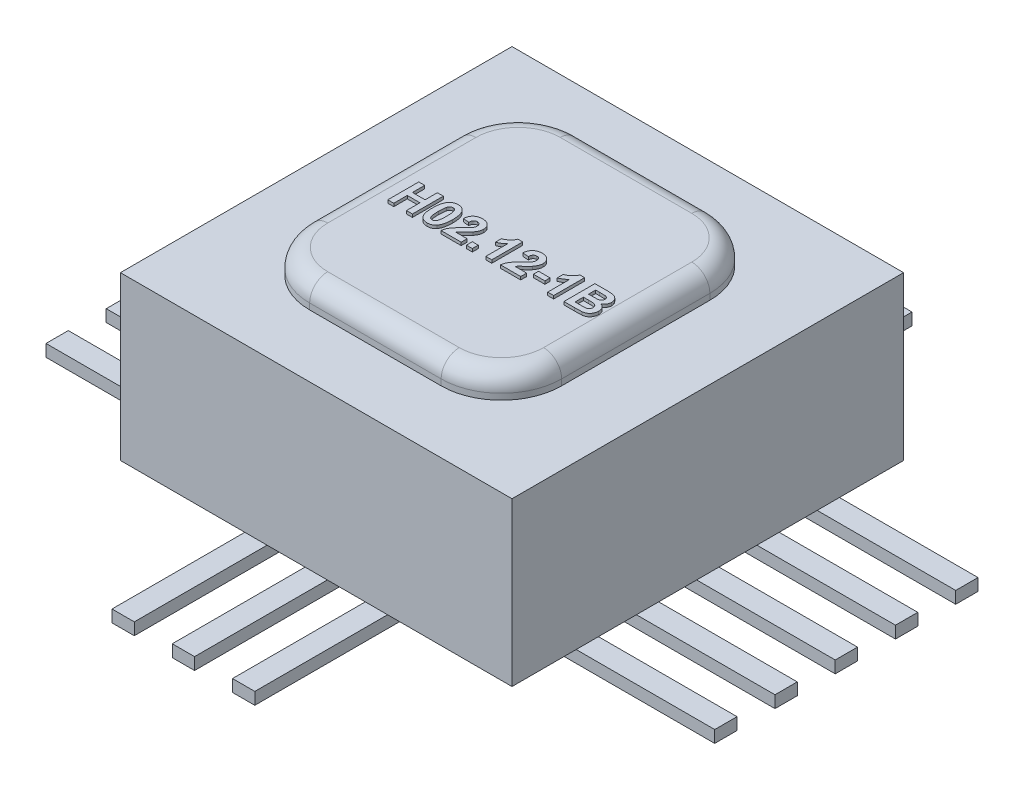
from build123d import *

# Parameters (mm, degrees)
SKETCH_1_W      = 6.5
SKETCH_1_H      = 6.5
EXTRUDE_1_DEPTH = 2.7
EXTRUDE_2_DEPTH = 0.4
SKETCH_3_W      = 0.098781487
SKETCH_3_H      = 0.098781488
SKETCH_3_W_2    = 0.190977544
SKETCH_3_H_2    = 0.085610623
EXTRUDE_3_DEPTH = 0.05
SKETCH_4_W      = 2.8
SKETCH_4_H      = 0.37
EXTRUDE_4_DEPTH = 0.2
FILLET_1_R      = 0.3


with BuildPart() as part:
    # Эскиз1 → Бобышка-Вытянуть1 (new body)
    with BuildSketch(Plane(origin=(0, 0, 0), x_dir=(1, 0, 0), z_dir=(0, 1, 0))):
        with Locations((-4.246969697, 1.663636364)):
            Rectangle(SKETCH_1_W, SKETCH_1_H)
    extrude(amount=EXTRUDE_1_DEPTH)

    # Эскиз2 → Бобышка-Вытянуть2 (add)
    with BuildSketch(Plane(origin=(0, 2.7, 0), x_dir=(1, 0, 0), z_dir=(0, 1, 0))):
        with BuildLine():
            Line((-5.389923562, 3.908173911), (-3.207496013, 3.908173911))
            ThreePointArc((-3.207496013, 3.908173911), (-2.500389232, 3.615280692), (-2.207496013, 2.908173911))
            Line((-2.207496013, 2.908173911), (-2.207496013, 0.448176813))
            ThreePointArc((-2.207496013, 0.448176813), (-2.500389232, -0.258929968), (-3.207496013, -0.551823187))
            Line((-3.207496013, -0.551823187), (-5.389923562, -0.551823187))
            ThreePointArc((-5.389923562, -0.551823187), (-6.097030343, -0.258929968), (-6.389923562, 0.448176813))
            Line((-6.389923562, 0.448176813), (-6.389923562, 2.908173911))
            ThreePointArc((-6.389923562, 2.908173911), (-6.097030343, 3.615280692), (-5.389923562, 3.908173911))
        make_face()
    extrude(amount=EXTRUDE_2_DEPTH)

    # Эскиз3 → Бобышка-Вытянуть3 (add)
    # profile 1 of 9: a face of its own
    with BuildSketch(Plane(origin=(0, 3.1, 0), x_dir=(1, 0, 0), z_dir=(0, 1, 0))):
        Polygon((-5.875120477, 1.230387729), (-5.875120477, 1.744051466), (-5.77633899, 1.744051466), (-5.77633899, 1.539903058), (-5.565605149, 1.539903058), (-5.565605149, 1.744051466), (-5.466823661, 1.744051466), (-5.466823661, 1.230387729), (-5.565605149, 1.230387729), (-5.565605149, 1.454292435), (-5.77633899, 1.454292435), (-5.77633899, 1.230387729), align=None)
    # profile 2 of 9: a face of its own
    with BuildSketch(Plane(origin=(0, 3.1, 0), x_dir=(1, 0, 0), z_dir=(0, 1, 0))):
        with BuildLine():
            add(Edge.make_bspline(
                [(-5.219869941, 1.744051466), (-5.213755631, 1.743903993), (-5.201851771, 1.743616879), (-5.184506535, 1.741073574), (-5.168175133, 1.736995527), (-5.152858762, 1.731230917), (-5.138571772, 1.723745239), (-5.125409327, 1.714506502), (-5.113083812, 1.703791648), (-5.105966277, 1.695476743), (-5.10236113, 1.691265108)],
                knots=[0, 0, 0, 0, 1.098584764, 2.138818609, 3.143716932, 4.11936356, 5.073598562, 6.034819447, 7.004603936, 8, 8, 8, 8], degree=3))
            add(Edge.make_bspline(
                [(-5.10236113, 1.691265108), (-5.100298928, 1.688582853), (-5.096090335, 1.68310884), (-5.090422306, 1.67426344), (-5.084973267, 1.664880422), (-5.080216789, 1.654733933), (-5.075662254, 1.644000048), (-5.071441496, 1.63265431), (-5.067776742, 1.620602975), (-5.064328424, 1.608000142), (-5.061518361, 1.594648985), (-5.058921603, 1.580693636), (-5.056768773, 1.566070831), (-5.05507114, 1.550827354), (-5.053554986, 1.534986398), (-5.052724207, 1.518472371), (-5.052043976, 1.501322147), (-5.051975993, 1.489655609), (-5.051941412, 1.483721086)],
                knots=[0, 0, 0, 0, 0.746761706, 1.524009783, 2.317797294, 3.140957436, 3.996208027, 4.892396322, 5.812273159, 6.776774596, 7.776522781, 8.823794876, 9.910947555, 11.039215469, 12.21036455, 13.424061321, 14.689674014, 16, 16, 16, 16], degree=3))
            add(Edge.make_bspline(
                [(-5.051941412, 1.483721086), (-5.051975472, 1.47778655), (-5.052042234, 1.466154265), (-5.052726743, 1.449038447), (-5.053555727, 1.432558851), (-5.055067603, 1.416717049), (-5.056781491, 1.401476602), (-5.058872769, 1.386870189), (-5.061664937, 1.372978966), (-5.064430795, 1.359649102), (-5.067858897, 1.34699261), (-5.071688337, 1.334962887), (-5.075739452, 1.323475714), (-5.08039988, 1.31272801), (-5.085327023, 1.302568965), (-5.09069497, 1.293090173), (-5.096426287, 1.284189955), (-5.100675595, 1.278687063), (-5.102772719, 1.27597127)],
                knots=[0, 0, 0, 0, 1.308387162, 2.564569672, 3.776470597, 4.945886788, 6.07248526, 7.158029334, 8.197718558, 9.195987466, 10.159061779, 11.087054987, 11.979325145, 12.84323098, 13.668471539, 14.467659354, 15.243757377, 16, 16, 16, 16], degree=3))
            add(Edge.make_bspline(
                [(-5.102772719, 1.27597127), (-5.106344882, 1.271795734), (-5.113396504, 1.263553026), (-5.125585605, 1.252927031), (-5.138726229, 1.243879364), (-5.152988055, 1.236542445), (-5.168229585, 1.230738059), (-5.184587713, 1.226790142), (-5.201885563, 1.22424166), (-5.213789641, 1.22395084), (-5.219869941, 1.223802296)],
                knots=[0, 0, 0, 0, 0.991631672, 1.957528776, 2.911425699, 3.867574088, 4.848108326, 5.850523106, 6.902101959, 8, 8, 8, 8], degree=3))
            add(Edge.make_bspline(
                [(-5.219869941, 1.223802296), (-5.226019737, 1.223979255), (-5.23807058, 1.224326013), (-5.255665334, 1.227074869), (-5.272389954, 1.231478519), (-5.288184401, 1.237765757), (-5.303026075, 1.245913557), (-5.317030926, 1.255680521), (-5.329894263, 1.267508902), (-5.339964853, 1.278520471), (-5.347332527, 1.288470234), (-5.352528902, 1.296720934), (-5.357550644, 1.305549511), (-5.361885011, 1.315231993), (-5.366161249, 1.325482), (-5.369948652, 1.336520433), (-5.373290123, 1.348252374), (-5.376427551, 1.360624251), (-5.379043704, 1.373721281), (-5.381450181, 1.387504815), (-5.383346615, 1.402033471), (-5.385027998, 1.417226325), (-5.386211789, 1.433119244), (-5.387173178, 1.449686217), (-5.387655248, 1.466980277), (-5.38775009, 1.47874749), (-5.387798471, 1.48475006)],
                knots=[0, 0, 0, 0, 1.257818097, 2.464759732, 3.634271214, 4.790227596, 5.933394726, 7.09190477, 8.274482889, 9.50191983, 10.139172818, 10.805000628, 11.49619854, 12.215266328, 12.973768034, 13.768328009, 14.601232062, 15.469317089, 16.379095881, 17.333267023, 18.331755967, 19.376479622, 20.460535752, 21.592206075, 22.771760786, 24, 24, 24, 24], degree=3))
            add(Edge.make_bspline(
                [(-5.387798471, 1.48475006), (-5.387764682, 1.490650321), (-5.387698461, 1.502214074), (-5.387008961, 1.519260962), (-5.386190932, 1.535672889), (-5.384662599, 1.55147858), (-5.382972751, 1.566653949), (-5.380842724, 1.581219001), (-5.378119978, 1.595098381), (-5.375155496, 1.608347483), (-5.371903663, 1.621013228), (-5.368038623, 1.632989746), (-5.364027998, 1.644458174), (-5.3593131, 1.655148549), (-5.354416207, 1.665286213), (-5.34904406, 1.674763228), (-5.3433138, 1.683663894), (-5.339064355, 1.689166728), (-5.336967163, 1.691882493)],
                knots=[0, 0, 0, 0, 1.304469132, 2.556591843, 3.77188756, 4.93702727, 6.066781583, 7.147865049, 8.190466662, 9.19316792, 10.149665317, 11.080258032, 11.975027628, 12.834388201, 13.661940433, 14.463366943, 15.241638981, 16, 16, 16, 16], degree=3))
            add(Edge.make_bspline(
                [(-5.336967163, 1.691882493), (-5.333395197, 1.69605843), (-5.326343963, 1.704301931), (-5.314152023, 1.714922121), (-5.300996871, 1.724008842), (-5.286693306, 1.731257941), (-5.271486717, 1.737141902), (-5.255149996, 1.741058316), (-5.237854902, 1.743613525), (-5.225950438, 1.743903403), (-5.219869941, 1.744051466)],
                knots=[0, 0, 0, 0, 0.991667276, 1.957599061, 2.911530233, 3.873218945, 4.847995157, 5.850445929, 6.902062539, 8, 8, 8, 8], degree=3))
        make_face()
        with BuildLine():
            add(Edge.make_bspline(
                [(-5.219869941, 1.658440843), (-5.22300218, 1.658297312), (-5.229198033, 1.658013393), (-5.238203568, 1.655909283), (-5.246708554, 1.652437043), (-5.254753989, 1.647589841), (-5.262162089, 1.640846715), (-5.268437415, 1.631805631), (-5.273856918, 1.620710722), (-5.276569082, 1.612417735), (-5.278006963, 1.608021125)],
                knots=[0, 0, 0, 0, 0.899391665, 1.779078861, 2.640979247, 3.529945348, 4.464599804, 5.495588918, 6.672261578, 8, 8, 8, 8], degree=3))
            add(Edge.make_bspline(
                [(-5.278006963, 1.608021125), (-5.278904944, 1.604703762), (-5.280834943, 1.59757387), (-5.283025412, 1.585949182), (-5.284831847, 1.572756392), (-5.286357199, 1.557998566), (-5.287598513, 1.541667895), (-5.288362958, 1.523753987), (-5.288891328, 1.504269394), (-5.288973983, 1.490752808), (-5.289016983, 1.483721086)],
                knots=[0, 0, 0, 0, 0.658986521, 1.416336438, 2.266694271, 3.212608458, 4.261595115, 5.407496572, 6.651304179, 8, 8, 8, 8], degree=3))
            add(Edge.make_bspline(
                [(-5.289016983, 1.483721086), (-5.28895836, 1.476724151), (-5.288845991, 1.463312198), (-5.2885269, 1.444061929), (-5.287621155, 1.426538758), (-5.286714591, 1.410672856), (-5.285204669, 1.396514212), (-5.283686001, 1.384024595), (-5.281592768, 1.373289304), (-5.278736672, 1.361612744), (-5.274417193, 1.349391372), (-5.268490996, 1.337061801), (-5.262136087, 1.327161733), (-5.254651143, 1.320073351), (-5.24655024, 1.31531829), (-5.23814798, 1.311824497), (-5.229150646, 1.309864004), (-5.223000034, 1.309565056), (-5.219869941, 1.309412919)],
                knots=[0, 0, 0, 0, 1.613353868, 3.092528792, 4.438413522, 5.658843895, 6.755779493, 7.721003256, 8.558527904, 9.275869043, 10.491421475, 11.538327284, 12.426656321, 13.187490948, 13.890032692, 14.581719216, 15.278226227, 16, 16, 16, 16], degree=3))
            add(Edge.make_bspline(
                [(-5.219869941, 1.309412919), (-5.216701681, 1.309549171), (-5.210501516, 1.30981581), (-5.201484182, 1.311990076), (-5.192967087, 1.315357909), (-5.184975486, 1.32030394), (-5.177574324, 1.327000894), (-5.171303579, 1.336050102), (-5.165882627, 1.347142442), (-5.163170684, 1.35543582), (-5.16173292, 1.359832637)],
                knots=[0, 0, 0, 0, 0.909107913, 1.77908945, 2.650019014, 3.530482969, 4.465025013, 5.495890128, 6.672421267, 8, 8, 8, 8], degree=3))
            add(Edge.make_bspline(
                [(-5.16173292, 1.359832637), (-5.160836237, 1.363150264), (-5.158917815, 1.370248217), (-5.156711737, 1.381800538), (-5.154900412, 1.394924963), (-5.153389563, 1.409615656), (-5.152136039, 1.425911052), (-5.151378084, 1.443791174), (-5.150849217, 1.463241364), (-5.150766059, 1.476723659), (-5.1507229, 1.483721086)],
                knots=[0, 0, 0, 0, 0.66114423, 1.414496391, 2.261103113, 3.210114492, 4.255954433, 5.405607896, 6.653488082, 8, 8, 8, 8], degree=3))
            add(Edge.make_bspline(
                [(-5.1507229, 1.483721086), (-5.150718128, 1.490718755), (-5.15070898, 1.504133168), (-5.151315072, 1.523407872), (-5.151909899, 1.540982659), (-5.153122852, 1.556823101), (-5.154337732, 1.570982696), (-5.1561476, 1.583390552), (-5.157970901, 1.594183424), (-5.161086926, 1.605835651), (-5.165321629, 1.618092145), (-5.171107034, 1.630549834), (-5.177646835, 1.640357099), (-5.185077528, 1.64756593), (-5.193138557, 1.652425508), (-5.201561437, 1.655929903), (-5.2105434, 1.658009923), (-5.216738224, 1.658296146), (-5.219869941, 1.658440843)],
                knots=[0, 0, 0, 0, 1.611146624, 3.088541111, 4.440175916, 5.659517762, 6.746360572, 7.711365618, 8.546319149, 9.264661039, 10.486047304, 11.528122518, 12.419721574, 13.184982167, 13.89070983, 14.574167459, 15.279187713, 16, 16, 16, 16], degree=3))
        make_face(mode=Mode.SUBTRACT)
    # profile 3 of 9: a face of its own
    with BuildSketch(Plane(origin=(0, 3.1, 0), x_dir=(1, 0, 0), z_dir=(0, 1, 0))):
        with BuildLine():
            Line((-4.65681546, 1.329169217), (-4.65681546, 1.230387729))
            Line((-4.65681546, 1.230387729), (-4.992672519, 1.230387729))
            add(Edge.make_bspline(
                [(-4.992672519, 1.230387729), (-4.991535385, 1.23883004), (-4.989261754, 1.255709929), (-4.982232501, 1.280367199), (-4.972850855, 1.30442848), (-4.962668861, 1.324008524), (-4.95254174, 1.339769784), (-4.943353402, 1.352684683), (-4.932392053, 1.366425582), (-4.919816752, 1.381103406), (-4.905696998, 1.39676404), (-4.889927446, 1.413349259), (-4.872432875, 1.430779666), (-4.860125132, 1.442615771), (-4.853761052, 1.448735976)],
                knots=[0, 0, 0, 0, 1.156289446, 2.311930546, 3.473459201, 4.661751613, 5.303057008, 6.018253237, 6.81459331, 7.690699809, 8.644447906, 9.679642995, 10.800191253, 12, 12, 12, 12], degree=3))
            add(Edge.make_bspline(
                [(-4.853761052, 1.448735976), (-4.848682443, 1.453638224), (-4.839014268, 1.46297066), (-4.825246768, 1.476334329), (-4.813143717, 1.48861934), (-4.802452057, 1.499507335), (-4.79341878, 1.50927555), (-4.785925061, 1.517770577), (-4.779875995, 1.525027009), (-4.776599815, 1.529630494), (-4.775147451, 1.531671267)],
                knots=[0, 0, 0, 0, 1.480720495, 2.818855715, 4.024636094, 5.098235712, 6.019786162, 6.815086302, 7.474715479, 8, 8, 8, 8], degree=3))
            add(Edge.make_bspline(
                [(-4.775147451, 1.531671267), (-4.772173363, 1.536611544), (-4.766436692, 1.546140767), (-4.760145957, 1.561125643), (-4.756370023, 1.576107423), (-4.755851863, 1.586118163), (-4.755596948, 1.591043057)],
                knots=[0, 0, 0, 0, 1.0911822, 2.104764037, 3.067617678, 4, 4, 4, 4], degree=3))
            add(Edge.make_bspline(
                [(-4.755596948, 1.591043057), (-4.755781953, 1.596168072), (-4.756131967, 1.6058642), (-4.759066896, 1.619547229), (-4.764271517, 1.631309732), (-4.771437322, 1.641187812), (-4.780498496, 1.64892725), (-4.791091273, 1.654645943), (-4.803370713, 1.657807635), (-4.812001428, 1.658223497), (-4.816512199, 1.658440843)],
                knots=[0, 0, 0, 0, 1.193122327, 2.257294386, 3.237245624, 4.168877528, 5.075331632, 5.990371598, 6.949684428, 8, 8, 8, 8], degree=3))
            add(Edge.make_bspline(
                [(-4.816512199, 1.658440843), (-4.820992496, 1.658237858), (-4.829647462, 1.657845734), (-4.841948047, 1.654420195), (-4.852708789, 1.648490226), (-4.860377466, 1.641732454), (-4.865558021, 1.635161012), (-4.86908787, 1.629434433), (-4.872130325, 1.622927283), (-4.874826194, 1.615712822), (-4.876955625, 1.607708401), (-4.878670537, 1.59897498), (-4.880052508, 1.589465563), (-4.880491999, 1.582850134), (-4.880720166, 1.579415653)],
                knots=[0, 0, 0, 0, 1.402788338, 2.709884207, 3.961032948, 5.225417836, 5.883680772, 6.578928686, 7.329201998, 8.132101139, 8.990263233, 9.922304639, 10.921339128, 12, 12, 12, 12], degree=3))
            Line((-4.880720166, 1.579415653), (-4.979501654, 1.589088007))
            add(Edge.make_bspline(
                [(-4.979501654, 1.589088007), (-4.978707466, 1.595757002), (-4.977167663, 1.608687119), (-4.973325058, 1.627259225), (-4.968458541, 1.644392831), (-4.962336108, 1.66005614), (-4.955210809, 1.674348756), (-4.946719192, 1.687056209), (-4.937157964, 1.698319262), (-4.926518862, 1.70813192), (-4.914869522, 1.7165254), (-4.902645629, 1.724017869), (-4.889608296, 1.730164075), (-4.875901063, 1.735229473), (-4.861530126, 1.739277698), (-4.846429015, 1.741954329), (-4.830690931, 1.743837082), (-4.819948048, 1.743978928), (-4.814454251, 1.744051466)],
                knots=[0, 0, 0, 0, 1.270971563, 2.464210789, 3.586263665, 4.638946707, 5.643716971, 6.603612468, 7.52484387, 8.434700188, 9.336036235, 10.239171475, 11.145359471, 12.059630629, 13.003312604, 13.96741569, 14.960557767, 16, 16, 16, 16], degree=3))
            add(Edge.make_bspline(
                [(-4.814454251, 1.744051466), (-4.808481784, 1.743936678), (-4.796849655, 1.743713115), (-4.779868811, 1.741866926), (-4.763916528, 1.738647828), (-4.74885334, 1.734383677), (-4.734833938, 1.728690723), (-4.721741499, 1.721808179), (-4.709782075, 1.713474838), (-4.698777394, 1.704145153), (-4.68894009, 1.693885524), (-4.680323501, 1.682941895), (-4.673104552, 1.67132189), (-4.667046745, 1.659167146), (-4.662548864, 1.646282073), (-4.659271513, 1.632844837), (-4.657098496, 1.618792752), (-4.656910849, 1.609195496), (-4.65681546, 1.60431682)],
                knots=[0, 0, 0, 0, 1.210756838, 2.35810096, 3.457354827, 4.507168606, 5.527358126, 6.519769748, 7.499700793, 8.476517721, 9.440526811, 10.376769937, 11.295256217, 12.209626307, 13.124630862, 14.055668209, 15.011616881, 16, 16, 16, 16], degree=3))
            add(Edge.make_bspline(
                [(-4.65681546, 1.60431682), (-4.656941134, 1.598717649), (-4.657190451, 1.587609754), (-4.659577475, 1.571188967), (-4.663224385, 1.555146841), (-4.668614229, 1.539444171), (-4.675446275, 1.523704286), (-4.684252947, 1.507891856), (-4.694478159, 1.491530007), (-4.702484096, 1.480951358), (-4.706617794, 1.475489296)],
                knots=[0, 0, 0, 0, 0.953409949, 1.89141903, 2.821310783, 3.752688675, 4.715703262, 5.740811754, 6.833515735, 8, 8, 8, 8], degree=3))
            add(Edge.make_bspline(
                [(-4.706617794, 1.475489296), (-4.70818015, 1.473521504), (-4.711526355, 1.469306949), (-4.717219128, 1.462844581), (-4.723816563, 1.455785638), (-4.731225473, 1.447997993), (-4.739690589, 1.439757428), (-4.748907337, 1.430719328), (-4.759281279, 1.421346023), (-4.770026169, 1.411403694), (-4.780817764, 1.401726965), (-4.790736796, 1.392536218), (-4.799746577, 1.38440438), (-4.807427505, 1.376882538), (-4.814231371, 1.370484051), (-4.81991294, 1.364880813), (-4.824578529, 1.360208473), (-4.83100741, 1.35292548), (-4.839187431, 1.34307523), (-4.84494241, 1.333663037), (-4.847690106, 1.329169217)],
                knots=[0, 0, 0, 0, 0.665555651, 1.425465941, 2.280616993, 3.225313414, 4.272635571, 5.410053715, 6.644756443, 7.976022804, 9.288331007, 10.484517221, 11.558462543, 12.503158964, 13.33222979, 14.032602617, 14.617328242, 15.080653724, 16.606167857, 18, 18, 18, 18], degree=3))
            Line((-4.847690106, 1.329169217), (-4.65681546, 1.329169217))
        make_face()
    # profile 4 of 9: a face of its own
    with BuildSketch(Plane(origin=(0, 3.1, 0), x_dir=(1, 0, 0), z_dir=(0, 1, 0))):
        with Locations((-4.521814094, 1.279778473)):
            Rectangle(SKETCH_3_W, SKETCH_3_H)
    # profile 5 of 9: a face of its own
    with BuildSketch(Plane(origin=(0, 3.1, 0), x_dir=(1, 0, 0), z_dir=(0, 1, 0))):
        with BuildLine():
            Line((-4.149737156, 1.230387729), (-4.248518644, 1.230387729))
            Line((-4.248518644, 1.230387729), (-4.248518644, 1.596085029))
            add(Edge.make_bspline(
                [(-4.248518644, 1.596085029), (-4.252995951, 1.591539726), (-4.261889827, 1.582510783), (-4.276094748, 1.569916611), (-4.290841622, 1.558200711), (-4.306276382, 1.547474362), (-4.322197257, 1.537584732), (-4.338766948, 1.528609855), (-4.355865355, 1.52042555), (-4.367710161, 1.515851795), (-4.373641862, 1.513561328)],
                knots=[0, 0, 0, 0, 1.012567276, 2.011397996, 3.011400399, 4.000747768, 4.993445519, 5.985067596, 6.990952157, 8, 8, 8, 8], degree=3))
            Line((-4.373641862, 1.513561328), (-4.373641862, 1.612342815))
            add(Edge.make_bspline(
                [(-4.373641862, 1.612342815), (-4.367063307, 1.614809491), (-4.353294903, 1.619972052), (-4.33297737, 1.630953079), (-4.311770454, 1.6445487), (-4.293955434, 1.657882855), (-4.27981104, 1.669737984), (-4.269925184, 1.679267648), (-4.26076537, 1.689026518), (-4.252675898, 1.699329575), (-4.245444414, 1.709968514), (-4.239037003, 1.720925954), (-4.23339701, 1.732236509), (-4.230444512, 1.740112928), (-4.228968141, 1.744051466)],
                knots=[0, 0, 0, 0, 1.253673617, 2.623841347, 4.114270668, 5.751233548, 6.594491912, 7.409089316, 8.202422231, 8.983165545, 9.746111525, 10.498431446, 11.249153235, 12, 12, 12, 12], degree=3))
            Line((-4.228968141, 1.744051466), (-4.149737156, 1.744051466))
            Line((-4.149737156, 1.744051466), (-4.149737156, 1.230387729))
        make_face()
    # profile 6 of 9: a face of its own
    with BuildSketch(Plane(origin=(0, 3.1, 0), x_dir=(1, 0, 0), z_dir=(0, 1, 0))):
        with BuildLine():
            Line((-3.669000581, 1.329169217), (-3.669000581, 1.230387729))
            Line((-3.669000581, 1.230387729), (-4.00485764, 1.230387729))
            add(Edge.make_bspline(
                [(-4.00485764, 1.230387729), (-4.003720506, 1.23883004), (-4.001446875, 1.255709929), (-3.994417622, 1.280367199), (-3.985035976, 1.30442848), (-3.974853982, 1.324008524), (-3.964726861, 1.339769784), (-3.955538523, 1.352684683), (-3.944577174, 1.366425582), (-3.932001874, 1.381103406), (-3.917882119, 1.39676404), (-3.902112567, 1.413349259), (-3.884617996, 1.430779666), (-3.872310253, 1.442615771), (-3.865946173, 1.448735976)],
                knots=[0, 0, 0, 0, 1.156289446, 2.311930546, 3.473459201, 4.661751613, 5.303057008, 6.018253237, 6.81459331, 7.690699809, 8.644447906, 9.679642995, 10.800191253, 12, 12, 12, 12], degree=3))
            add(Edge.make_bspline(
                [(-3.865946173, 1.448735976), (-3.860867564, 1.453638224), (-3.851199389, 1.46297066), (-3.837431889, 1.476334329), (-3.825328838, 1.48861934), (-3.814637178, 1.499507335), (-3.805603901, 1.50927555), (-3.798110183, 1.517770577), (-3.792061116, 1.525027009), (-3.788784937, 1.529630494), (-3.787332572, 1.531671267)],
                knots=[0, 0, 0, 0, 1.480720495, 2.818855715, 4.024636094, 5.098235712, 6.019786162, 6.815086302, 7.474715479, 8, 8, 8, 8], degree=3))
            add(Edge.make_bspline(
                [(-3.787332572, 1.531671267), (-3.784358484, 1.536611544), (-3.778621814, 1.546140767), (-3.772331078, 1.561125643), (-3.768555144, 1.576107423), (-3.768036984, 1.586118163), (-3.767782069, 1.591043057)],
                knots=[0, 0, 0, 0, 1.0911822, 2.104764037, 3.067617678, 4, 4, 4, 4], degree=3))
            add(Edge.make_bspline(
                [(-3.767782069, 1.591043057), (-3.767967074, 1.596168072), (-3.768317088, 1.6058642), (-3.771252017, 1.619547229), (-3.776456638, 1.631309732), (-3.783622443, 1.641187812), (-3.792683617, 1.64892725), (-3.803276394, 1.654645943), (-3.815555834, 1.657807635), (-3.824186549, 1.658223497), (-3.82869732, 1.658440843)],
                knots=[0, 0, 0, 0, 1.193122327, 2.257294386, 3.237245624, 4.168877528, 5.075331632, 5.990371598, 6.949684428, 8, 8, 8, 8], degree=3))
            add(Edge.make_bspline(
                [(-3.82869732, 1.658440843), (-3.833177617, 1.658237858), (-3.841832584, 1.657845734), (-3.854133169, 1.654420195), (-3.86489391, 1.648490226), (-3.872562587, 1.641732454), (-3.877743142, 1.635161012), (-3.881272992, 1.629434433), (-3.884315446, 1.622927283), (-3.887011315, 1.615712822), (-3.889140746, 1.607708401), (-3.890855658, 1.59897498), (-3.892237629, 1.589465563), (-3.89267712, 1.582850134), (-3.892905287, 1.579415653)],
                knots=[0, 0, 0, 0, 1.402788338, 2.709884207, 3.961032948, 5.225417836, 5.883680772, 6.578928686, 7.329201998, 8.132101139, 8.990263233, 9.922304639, 10.921339128, 12, 12, 12, 12], degree=3))
            Line((-3.892905287, 1.579415653), (-3.991686775, 1.589088007))
            add(Edge.make_bspline(
                [(-3.991686775, 1.589088007), (-3.990892587, 1.595757002), (-3.989352784, 1.608687119), (-3.985510179, 1.627259225), (-3.980643662, 1.644392831), (-3.97452123, 1.66005614), (-3.96739593, 1.674348756), (-3.958904313, 1.687056209), (-3.949343085, 1.698319262), (-3.938703983, 1.70813192), (-3.927054643, 1.7165254), (-3.914830751, 1.724017869), (-3.901793417, 1.730164075), (-3.888086185, 1.735229473), (-3.873715247, 1.739277698), (-3.858614136, 1.741954329), (-3.842876052, 1.743837082), (-3.83213317, 1.743978928), (-3.826639373, 1.744051466)],
                knots=[0, 0, 0, 0, 1.270971563, 2.464210789, 3.586263665, 4.638946707, 5.643716971, 6.603612468, 7.52484387, 8.434700188, 9.336036235, 10.239171475, 11.145359471, 12.059630629, 13.003312604, 13.96741569, 14.960557767, 16, 16, 16, 16], degree=3))
            add(Edge.make_bspline(
                [(-3.826639373, 1.744051466), (-3.820666905, 1.743936678), (-3.809034776, 1.743713115), (-3.792053932, 1.741866926), (-3.776101649, 1.738647828), (-3.761038461, 1.734383677), (-3.747019059, 1.728690723), (-3.73392662, 1.721808179), (-3.721967196, 1.713474838), (-3.710962515, 1.704145153), (-3.701125211, 1.693885524), (-3.692508623, 1.682941895), (-3.685289673, 1.67132189), (-3.679231866, 1.659167146), (-3.674733985, 1.646282073), (-3.671456634, 1.632844837), (-3.669283618, 1.618792752), (-3.66909597, 1.609195496), (-3.669000581, 1.60431682)],
                knots=[0, 0, 0, 0, 1.210756838, 2.35810096, 3.457354827, 4.507168606, 5.527358126, 6.519769748, 7.499700793, 8.476517721, 9.440526811, 10.376769937, 11.295256217, 12.209626307, 13.124630862, 14.055668209, 15.011616881, 16, 16, 16, 16], degree=3))
            add(Edge.make_bspline(
                [(-3.669000581, 1.60431682), (-3.669126255, 1.598717649), (-3.669375572, 1.587609754), (-3.671762597, 1.571188967), (-3.675409506, 1.555146841), (-3.68079935, 1.539444171), (-3.687631397, 1.523704286), (-3.696438068, 1.507891856), (-3.70666328, 1.491530007), (-3.714669218, 1.480951358), (-3.718802915, 1.475489296)],
                knots=[0, 0, 0, 0, 0.953409949, 1.89141903, 2.821310783, 3.752688675, 4.715703262, 5.740811754, 6.833515735, 8, 8, 8, 8], degree=3))
            add(Edge.make_bspline(
                [(-3.718802915, 1.475489296), (-3.720365271, 1.473521504), (-3.723711476, 1.469306949), (-3.729404249, 1.462844581), (-3.736001684, 1.455785638), (-3.743410594, 1.447997993), (-3.751875711, 1.439757428), (-3.761092458, 1.430719328), (-3.7714664, 1.421346023), (-3.78221129, 1.411403694), (-3.793002885, 1.401726965), (-3.802921917, 1.392536218), (-3.811931698, 1.38440438), (-3.819612626, 1.376882538), (-3.826416492, 1.370484051), (-3.832098061, 1.364880813), (-3.83676365, 1.360208473), (-3.843192531, 1.35292548), (-3.851372552, 1.34307523), (-3.857127532, 1.333663037), (-3.859875227, 1.329169217)],
                knots=[0, 0, 0, 0, 0.665555651, 1.425465941, 2.280616993, 3.225313414, 4.272635571, 5.410053715, 6.644756443, 7.976022804, 9.288331007, 10.484517221, 11.558462543, 12.503158964, 13.33222979, 14.032602617, 14.617328242, 15.080653724, 16.606167857, 18, 18, 18, 18], degree=3))
            Line((-3.859875227, 1.329169217), (-3.669000581, 1.329169217))
        make_face()
    # profile 7 of 9: a face of its own
    with BuildSketch(Plane(origin=(0, 3.1, 0), x_dir=(1, 0, 0), z_dir=(0, 1, 0))):
        with Locations((-3.501072052, 1.411487124)):
            Rectangle(SKETCH_3_W_2, SKETCH_3_H_2)
    # profile 8 of 9: a face of its own
    with BuildSketch(Plane(origin=(0, 3.1, 0), x_dir=(1, 0, 0), z_dir=(0, 1, 0))):
        with BuildLine():
            Line((-3.122409682, 1.230387729), (-3.22119117, 1.230387729))
            Line((-3.22119117, 1.230387729), (-3.22119117, 1.596085029))
            add(Edge.make_bspline(
                [(-3.22119117, 1.596085029), (-3.225668477, 1.591539726), (-3.234562353, 1.582510783), (-3.248767274, 1.569916611), (-3.263514148, 1.558200711), (-3.278948908, 1.547474362), (-3.294869783, 1.537584732), (-3.311439474, 1.528609855), (-3.328537881, 1.52042555), (-3.340382687, 1.515851795), (-3.346314388, 1.513561328)],
                knots=[0, 0, 0, 0, 1.012567276, 2.011397996, 3.011400399, 4.000747768, 4.993445519, 5.985067596, 6.990952157, 8, 8, 8, 8], degree=3))
            Line((-3.346314388, 1.513561328), (-3.346314388, 1.612342815))
            add(Edge.make_bspline(
                [(-3.346314388, 1.612342815), (-3.339735833, 1.614809491), (-3.325967429, 1.619972052), (-3.305649896, 1.630953079), (-3.28444298, 1.6445487), (-3.26662796, 1.657882855), (-3.252483566, 1.669737984), (-3.24259771, 1.679267648), (-3.233437896, 1.689026518), (-3.225348424, 1.699329575), (-3.21811694, 1.709968514), (-3.21170953, 1.720925954), (-3.206069536, 1.732236509), (-3.203117038, 1.740112928), (-3.201640667, 1.744051466)],
                knots=[0, 0, 0, 0, 1.253673617, 2.623841347, 4.114270668, 5.751233548, 6.594491912, 7.409089316, 8.202422231, 8.983165545, 9.746111525, 10.498431446, 11.249153235, 12, 12, 12, 12], degree=3))
            Line((-3.201640667, 1.744051466), (-3.122409682, 1.744051466))
            Line((-3.122409682, 1.744051466), (-3.122409682, 1.230387729))
        make_face()
    # profile 9 of 9: a face of its own
    with BuildSketch(Plane(origin=(0, 3.1, 0), x_dir=(1, 0, 0), z_dir=(0, 1, 0))):
        with BuildLine():
            Line((-2.951188436, 1.744051466), (-2.744261799, 1.744051466))
            add(Edge.make_bspline(
                [(-2.744261799, 1.744051466), (-2.739288469, 1.744021875), (-2.729684399, 1.743964731), (-2.715755897, 1.743805477), (-2.702827496, 1.743337788), (-2.690879066, 1.742936186), (-2.679950345, 1.741997006), (-2.66995544, 1.741259127), (-2.66092582, 1.740243998), (-2.650288692, 1.738601217), (-2.637919592, 1.736045987), (-2.623948996, 1.731319504), (-2.610706241, 1.725414225), (-2.598390377, 1.717906566), (-2.586960496, 1.709125888), (-2.57632918, 1.699142128), (-2.566986828, 1.687551853), (-2.558574188, 1.674901963), (-2.551473318, 1.661181836), (-2.54658349, 1.646421711), (-2.543462939, 1.630892217), (-2.54308471, 1.620246914), (-2.54289162, 1.614812353)],
                knots=[0, 0, 0, 0, 1.096610875, 2.117681168, 3.071055591, 3.949137991, 4.753059115, 5.489127199, 6.15892391, 6.75575099, 7.862330316, 8.938514814, 10.001276227, 11.05313779, 12.110449801, 13.174958802, 14.260456508, 15.384725817, 16.521138801, 17.654729897, 18.802709851, 20, 20, 20, 20], degree=3))
            add(Edge.make_bspline(
                [(-2.54289162, 1.614812353), (-2.543091882, 1.608894252), (-2.543486755, 1.597225072), (-2.547162147, 1.580113378), (-2.553016619, 1.563741457), (-2.561282293, 1.548374902), (-2.571406064, 1.534273354), (-2.583380793, 1.521890484), (-2.597030535, 1.511301582), (-2.607279885, 1.506032511), (-2.612450251, 1.503374487)],
                knots=[0, 0, 0, 0, 1.023065178, 2.01725758, 3.014298905, 4.023406433, 5.026736079, 6.009055718, 6.99565244, 8, 8, 8, 8], degree=3))
            add(Edge.make_bspline(
                [(-2.612450251, 1.503374487), (-2.60896791, 1.502188367), (-2.602082428, 1.499843103), (-2.59222692, 1.495536529), (-2.582992842, 1.490542209), (-2.574384831, 1.485017631), (-2.566337557, 1.478922408), (-2.559086128, 1.472054438), (-2.552214454, 1.464804458), (-2.546181657, 1.456808541), (-2.54072105, 1.448449119), (-2.536085811, 1.43959535), (-2.53207208, 1.43046019), (-2.528715322, 1.420951185), (-2.52632254, 1.411004559), (-2.524405293, 1.400745614), (-2.523424484, 1.390103247), (-2.523232501, 1.382917527), (-2.523135322, 1.379280242)],
                knots=[0, 0, 0, 0, 1.072651974, 2.1209089, 3.132484228, 4.131466326, 5.101889999, 6.071643115, 7.041396231, 8.011819904, 8.988565287, 9.95070344, 10.922775742, 11.897213062, 12.887138018, 13.903598663, 14.938838629, 16, 16, 16, 16], degree=3))
            add(Edge.make_bspline(
                [(-2.523135322, 1.379280242), (-2.523342009, 1.373471748), (-2.523754429, 1.361881574), (-2.526836392, 1.344591505), (-2.532041528, 1.327605945), (-2.539090356, 1.311035084), (-2.547845779, 1.295410106), (-2.558139114, 1.281144529), (-2.570148727, 1.268732103), (-2.583448334, 1.257794947), (-2.598434988, 1.248740542), (-2.615095885, 1.241785489), (-2.633325738, 1.236531083), (-2.646168583, 1.234785615), (-2.652786025, 1.23388624)],
                knots=[0, 0, 0, 0, 0.975059807, 1.945618526, 2.93861228, 3.952760547, 4.963632603, 5.940527786, 6.897802811, 7.855787948, 8.824773195, 9.82606706, 10.879852914, 12, 12, 12, 12], degree=3))
            add(Edge.make_bspline(
                [(-2.652786025, 1.23388624), (-2.655323517, 1.233672189), (-2.661148524, 1.233180818), (-2.671027413, 1.232569911), (-2.683173997, 1.232108133), (-2.697577729, 1.231562139), (-2.71428295, 1.231167915), (-2.733251693, 1.230898714), (-2.754516325, 1.230549343), (-2.769437209, 1.230443465), (-2.777291859, 1.230387729)],
                knots=[0, 0, 0, 0, 0.490565993, 1.126131979, 1.906526787, 2.832178623, 3.902933831, 5.125497984, 6.486805064, 8, 8, 8, 8], degree=3))
            Line((-2.777291859, 1.230387729), (-2.951188436, 1.230387729))
            Line((-2.951188436, 1.230387729), (-2.951188436, 1.744051466))
        make_face()
        with BuildLine():
            Line((-2.852406948, 1.658440843), (-2.852406948, 1.539903058))
            Line((-2.852406948, 1.539903058), (-2.780893267, 1.539903058))
            add(Edge.make_bspline(
                [(-2.780893267, 1.539903058), (-2.775851251, 1.53989195), (-2.766247281, 1.539870791), (-2.752596524, 1.540012578), (-2.740419529, 1.540078771), (-2.729751305, 1.540273036), (-2.720594041, 1.540593645), (-2.712980733, 1.5409138), (-2.706867387, 1.541156194), (-2.703307727, 1.541502322), (-2.701765179, 1.541652313)],
                knots=[0, 0, 0, 0, 1.528479216, 2.911428072, 4.138414629, 5.21998762, 6.145918986, 6.915989543, 7.530253335, 8, 8, 8, 8], degree=3))
            add(Edge.make_bspline(
                [(-2.701765179, 1.541652313), (-2.697316712, 1.542321706), (-2.688767031, 1.543608239), (-2.67680312, 1.547378081), (-2.666426012, 1.552830463), (-2.657520517, 1.559617238), (-2.650451413, 1.567943816), (-2.645263783, 1.577522395), (-2.642228638, 1.588393224), (-2.641862904, 1.596031346), (-2.641673108, 1.599995129)],
                knots=[0, 0, 0, 0, 1.162079002, 2.233444551, 3.225172046, 4.179556897, 5.110707885, 6.027301426, 6.976273101, 8, 8, 8, 8], degree=3))
            add(Edge.make_bspline(
                [(-2.641673108, 1.599995129), (-2.64179225, 1.603822705), (-2.642020973, 1.611170698), (-2.644862244, 1.621574437), (-2.649133881, 1.630917829), (-2.655377876, 1.638971328), (-2.663213126, 1.645772596), (-2.672803064, 1.65108532), (-2.684101637, 1.654740978), (-2.692240069, 1.656019586), (-2.696517413, 1.656691588)],
                knots=[0, 0, 0, 0, 1.044241546, 2.004684189, 2.928111627, 3.838334562, 4.769594837, 5.748424953, 6.81663206, 8, 8, 8, 8], degree=3))
            add(Edge.make_bspline(
                [(-2.696517413, 1.656691588), (-2.698197215, 1.656842033), (-2.70216857, 1.657197714), (-2.709070833, 1.657428933), (-2.717850104, 1.657754358), (-2.728551136, 1.658071956), (-2.741174215, 1.658265867), (-2.755683444, 1.658331222), (-2.772078172, 1.658473628), (-2.783637159, 1.658452175), (-2.789742442, 1.658440843)],
                knots=[0, 0, 0, 0, 0.433943041, 1.02591908, 1.776648879, 2.694999143, 3.780816848, 5.02540149, 6.428861738, 8, 8, 8, 8], degree=3))
            Line((-2.789742442, 1.658440843), (-2.852406948, 1.658440843))
        make_face(mode=Mode.SUBTRACT)
        with BuildLine():
            Line((-2.852406948, 1.454292435), (-2.852406948, 1.315998352))
            Line((-2.852406948, 1.315998352), (-2.751567513, 1.315998352))
            add(Edge.make_bspline(
                [(-2.751567513, 1.315998352), (-2.746868299, 1.315975041), (-2.737949527, 1.3159308), (-2.725226335, 1.316227125), (-2.713868336, 1.316324834), (-2.703822371, 1.316812312), (-2.695141228, 1.317181083), (-2.687789188, 1.317640819), (-2.681823655, 1.318371931), (-2.678303249, 1.31893953), (-2.676761115, 1.319188171)],
                knots=[0, 0, 0, 0, 1.504773752, 2.85595359, 4.075347731, 5.141676974, 6.076328919, 6.858106537, 7.499786952, 8, 8, 8, 8], degree=3))
            add(Edge.make_bspline(
                [(-2.676761115, 1.319188171), (-2.672844885, 1.320014469), (-2.665235956, 1.321619902), (-2.654690078, 1.326226703), (-2.645185366, 1.332068962), (-2.636953551, 1.33957749), (-2.630187426, 1.348572501), (-2.625301802, 1.359073805), (-2.622355442, 1.370957852), (-2.622067316, 1.379331007), (-2.62191681, 1.38370483)],
                knots=[0, 0, 0, 0, 1.031056579, 2.003262591, 2.954260215, 3.900917722, 4.862741126, 5.841340256, 6.872396835, 8, 8, 8, 8], degree=3))
            add(Edge.make_bspline(
                [(-2.62191681, 1.38370483), (-2.622038272, 1.38745576), (-2.622274685, 1.394756507), (-2.624588844, 1.405213426), (-2.628332376, 1.414774472), (-2.633545711, 1.423374401), (-2.640059136, 1.431121219), (-2.648111039, 1.437604223), (-2.657407148, 1.443005578), (-2.666269078, 1.446563931), (-2.674672485, 1.448846826), (-2.68268757, 1.450344449), (-2.692347387, 1.451529932), (-2.703605104, 1.452532719), (-2.716506404, 1.453334633), (-2.731016614, 1.45396681), (-2.747176226, 1.4542314), (-2.7584959, 1.454271444), (-2.764429686, 1.454292435)],
                knots=[0, 0, 0, 0, 0.992165387, 1.931134082, 2.820086661, 3.700270762, 4.583075858, 5.486803518, 6.423132184, 7.421722103, 8.005700193, 8.727213115, 9.57900282, 10.582332745, 11.720121093, 13.002085041, 14.428489784, 16, 16, 16, 16], degree=3))
            Line((-2.764429686, 1.454292435), (-2.852406948, 1.454292435))
        make_face(mode=Mode.SUBTRACT)
    extrude(amount=EXTRUDE_3_DEPTH)

    # Эскиз4 → Бобышка-Вытянуть4 (add)
    with BuildSketch(Plane.XZ):
        with Locations((-0.096969697, -1.663636364)):
            Rectangle(SKETCH_4_W, SKETCH_4_H)
        Polygon((-4.246969697, -4.31796007), (-4.061969697, -4.31796007), (-4.061969697, -7.11796007), (-4.431969697, -7.11796007), (-4.431969697, -4.31796007), align=None)
        Polygon((-3.246969697, -4.31796007), (-3.061969697, -4.31796007), (-3.061969697, -7.11796007), (-3.431969697, -7.11796007), (-3.431969697, -4.31796007), align=None)
        with Locations((-0.096969697, -2.663636364)):
            Rectangle(SKETCH_4_W, SKETCH_4_H)
        with Locations((-0.096969697, -3.663636364)):
            Rectangle(SKETCH_4_W, SKETCH_4_H)
        Polygon((-5.246969697, -4.31796007), (-5.061969697, -4.31796007), (-5.061969697, -7.11796007), (-5.431969697, -7.11796007), (-5.431969697, -4.31796007), align=None)
        with Locations((-8.396969697, 0.336363636)):
            Rectangle(SKETCH_4_W, SKETCH_4_H)
        with Locations((-0.096969697, -0.663636364)):
            Rectangle(SKETCH_4_W, SKETCH_4_H)
        with Locations((-0.096969697, 0.336363636)):
            Rectangle(SKETCH_4_W, SKETCH_4_H)
        with Locations((-8.396969697, -0.663636364)):
            Rectangle(SKETCH_4_W, SKETCH_4_H)
        with Locations((-8.396969697, -3.663636364)):
            Rectangle(SKETCH_4_W, SKETCH_4_H)
        with Locations((-8.396969697, -2.663636364)):
            Rectangle(SKETCH_4_W, SKETCH_4_H)
        with Locations((-8.396969697, -1.663636364)):
            Rectangle(SKETCH_4_W, SKETCH_4_H)
        Polygon((-5.431969697, 3.790687343), (-5.431969697, 0.990687343), (-5.246969697, 0.990687343), (-5.061969697, 0.990687343), (-5.061969697, 3.790687343), align=None)
        Polygon((-3.431969697, 3.790687343), (-3.431969697, 0.990687343), (-3.246969697, 0.990687343), (-3.061969697, 0.990687343), (-3.061969697, 3.790687343), align=None)
        Polygon((-4.431969697, 3.790687343), (-4.431969697, 0.990687343), (-4.246969697, 0.990687343), (-4.061969697, 0.990687343), (-4.061969697, 3.790687343), align=None)
    extrude(amount=EXTRUDE_4_DEPTH)

    # Скругление1
    fillet_1_edges = [part.edges().sort_by_distance(p)[0] for p in [
        (-2.500389232, 3.1, -3.615280692),
        (-4.298709788, 3.1, -3.908173911),
        (-6.097030343, 3.1, -3.615280692),
        (-6.389923562, 3.1, -1.678175362),
        (-6.097030343, 3.1, 0.258929968),
        (-4.298709788, 3.1, 0.551823187),
        (-2.500389232, 3.1, 0.258929968),
        (-2.207496013, 3.1, -1.678175362),
    ]]
    fillet(fillet_1_edges, radius=FILLET_1_R)


solid = part.part
